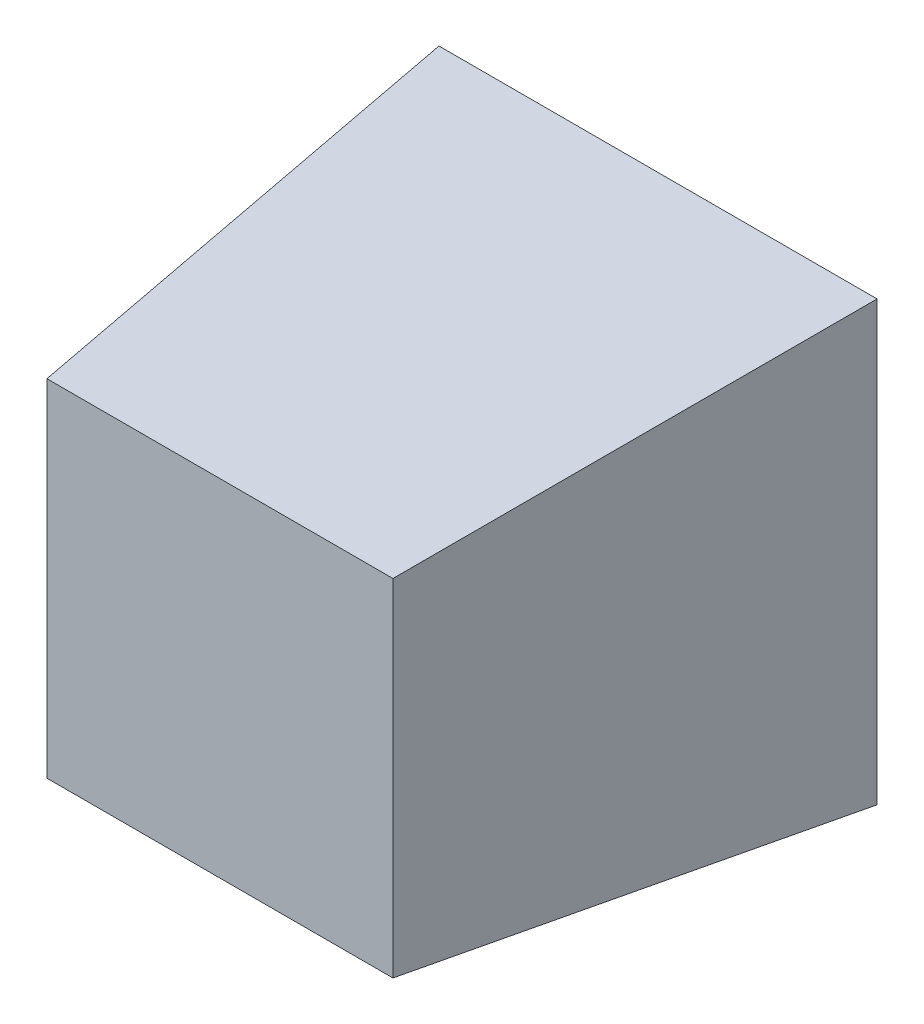
from build123d import *

# Parameters (mm, degrees)
SKETCH_1_W      = 10
SKETCH_1_H      = 10
EXTRUDE_1_DEPTH = 10
EXTRUDE_1_TAPER = 6


with BuildPart() as part:
    # 草图1 → 凸台-拉伸1 (new body)
    with BuildSketch(Plane.XY):
        with Locations((5, 5)):
            Rectangle(SKETCH_1_W, SKETCH_1_H)
    extrude(amount=EXTRUDE_1_DEPTH, taper=EXTRUDE_1_TAPER)


solid = part.part
